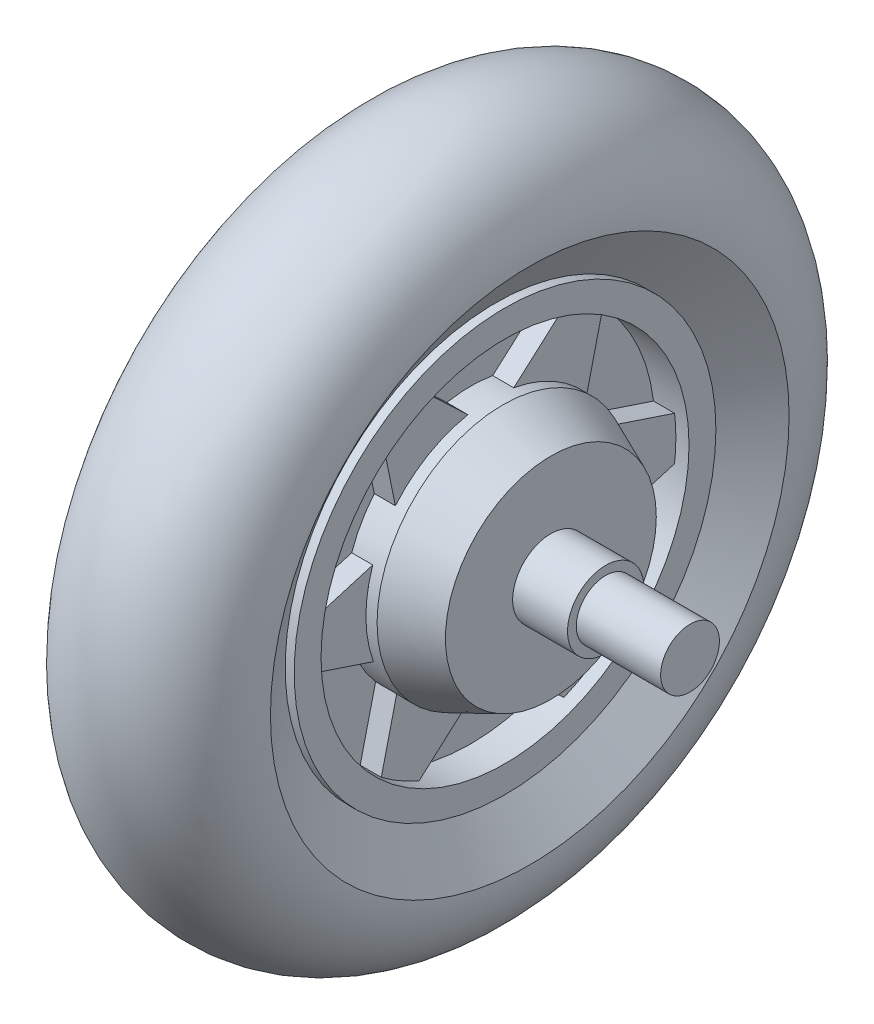
from build123d import *

# Parameters (mm, degrees)
BOSS_EXTRUDE2_DEPTH  = 5
CIRPATTERN1_COUNT    = 6
MIRROR1_COPY_1_DEPTH = 5
MIRROR1_COPY_2_DEPTH = 5
MIRROR1_COPY_3_DEPTH = 5
MIRROR1_COPY_4_DEPTH = 5
MIRROR1_COPY_5_DEPTH = 5


with BuildPart() as part:
    # Sketch2 → Revolve1 (revolve)
    with BuildSketch(Plane.XY, mode=Mode.PRIVATE) as revolve1_sk:
        with BuildLine():
            Line((-22, 61.489125293), (-14, 50))
            Line((-14, 50), (-8, 50))
            ThreePointArc((-8, 50), (-5.656854249, 44.343145751), (0, 42))
            ThreePointArc((0, 42), (5.656854249, 44.343145751), (8, 50))
            Line((8, 50), (14, 50))
            Line((14, 50), (22, 61.489125293))
            ThreePointArc((22, 61.489125293), (0, 83.489125293), (-22, 61.489125293))
        make_face()
    revolve(revolve1_sk.sketch.rotate(Axis((0, 0, 0), (1, 0, 0)), 90), axis=Axis((0, 0, 0), (1, 0, 0)))

    # Sketch3 → Revolve2 (revolve)
    with BuildSketch(Plane.XY, mode=Mode.PRIVATE) as revolve2_sk:
        with BuildLine():
            Line((-27, 9.055449855), (-40, 9.055449855))
            Line((-40, 9.055449855), (-40, 6.969952313))
            Line((-40, 6.969952313), (-60, 6.969952313))
            Line((-60, 6.969952313), (-60, 0))
            Line((-60, 0), (60, 0))
            Line((60, 0), (60, 6.969952313))
            Line((60, 6.969952313), (40, 6.969952313))
            Line((40, 6.969952313), (40, 9.055449855))
            Line((40, 9.055449855), (27, 9.055449855))
            Line((27, 9.055449855), (27, 25))
            Line((27, 25), (15.652221366, 29.861325966))
            Line((15.652221366, 29.861325966), (8, 29.861325966))
            Line((8, 29.861325966), (8, 43.630803847))
            Line((8, 43.630803847), (16.135165196, 43.630803847))
            Line((16.135165196, 43.630803847), (16.135165196, 50))
            Line((16.135165196, 50), (8, 50))
            ThreePointArc((8, 50), (0, 42), (-8, 50))
            Line((-8, 50), (-16.135165196, 50))
            Line((-16.135165196, 50), (-16.135165196, 43.630803847))
            Line((-16.135165196, 43.630803847), (-8, 43.630803847))
            Line((-8, 43.630803847), (-8, 29.861325966))
            Line((-8, 29.861325966), (-15.652221366, 29.861325966))
            Line((-15.652221366, 29.861325966), (-27, 25))
            Line((-27, 25), (-27, 9.055449855))
        make_face()
    revolve(revolve2_sk.sketch.rotate(Axis((-27, 0, 0), (-1, 0, 0)), 90), axis=Axis((-27, 0, 0), (-1, 0, 0)))

    # Sketch4 → Boss-Extrude2 (add)
    with BuildSketch(Plane(origin=(8, 0, 0), x_dir=(0, 0, -1), z_dir=(1, 0, 0))):
        with BuildLine():
            Line((-49.891400962, 3.293646928), (-28.226766869, 9.744148017))
            ThreePointArc((-28.226766869, 9.744148017), (-29.860364168, -0.239666883), (-28.066722375, -10.19597389))
            Line((-28.066722375, -10.19597389), (-49.91509062, -2.912684053))
            ThreePointArc((-49.91509062, -2.912684053), (-49.999635764, 0.190849359), (-49.891400962, 3.293646928))
        make_face()
    boss_extrude2 = extrude(amount=BOSS_EXTRUDE2_DEPTH)

    # CirPattern1: Boss-Extrude2 ×6 about axis
    cirpattern1_axis = Axis((0, 0, 0), (1, 0, 0))
    for i in range(1, CIRPATTERN1_COUNT):
        add(boss_extrude2.rotate(cirpattern1_axis, i * 360 / CIRPATTERN1_COUNT))

    # Mirror1: Boss-Extrude2 across plane
    add(boss_extrude2.mirror(Plane(origin=(0, 0, 0), x_dir=(0, 0, 1), z_dir=(1, 0, 0))))

    # Mirror1 copy 1 sketch → Mirror1 copy 1 (add)
    with BuildSketch(Plane(origin=(-8, 0, 0), x_dir=(0, 0.8660254037844386, -0.5000000000000001), z_dir=(-1, 0, 0))):
        with BuildLine():
            Line((-49.891400962, -3.293646928), (-28.226766869, -9.744148017))
            ThreePointArc((-28.226766869, -9.744148017), (-29.860364168, 0.239666883), (-28.066722375, 10.19597389))
            Line((-28.066722375, 10.19597389), (-49.91509062, 2.912684053))
            ThreePointArc((-49.91509062, 2.912684053), (-49.999635764, -0.190849359), (-49.891400962, -3.293646928))
        make_face()
    extrude(amount=MIRROR1_COPY_1_DEPTH)

    # Mirror1 copy 2 sketch → Mirror1 copy 2 (add)
    with BuildSketch(Plane(origin=(-8, 0, 0), x_dir=(0, 0.8660254037844387, 0.4999999999999998), z_dir=(-1, 0, 0))):
        with BuildLine():
            Line((-49.891400962, -3.293646928), (-28.226766869, -9.744148017))
            ThreePointArc((-28.226766869, -9.744148017), (-29.860364168, 0.239666883), (-28.066722375, 10.19597389))
            Line((-28.066722375, 10.19597389), (-49.91509062, 2.912684053))
            ThreePointArc((-49.91509062, 2.912684053), (-49.999635764, -0.190849359), (-49.891400962, -3.293646928))
        make_face()
    extrude(amount=MIRROR1_COPY_2_DEPTH)

    # Mirror1 copy 3 sketch → Mirror1 copy 3 (add)
    with BuildSketch(Plane.ZY.offset(8)):
        with BuildLine():
            Line((-49.891400962, -3.293646928), (-28.226766869, -9.744148017))
            ThreePointArc((-28.226766869, -9.744148017), (-29.860364168, 0.239666883), (-28.066722375, 10.19597389))
            Line((-28.066722375, 10.19597389), (-49.91509062, 2.912684053))
            ThreePointArc((-49.91509062, 2.912684053), (-49.999635764, -0.190849359), (-49.891400962, -3.293646928))
        make_face()
    extrude(amount=MIRROR1_COPY_3_DEPTH)

    # Mirror1 copy 4 sketch → Mirror1 copy 4 (add)
    with BuildSketch(Plane(origin=(-8, 0, 0), x_dir=(0, -0.8660254037844384, 0.5000000000000004), z_dir=(-1, 0, 0))):
        with BuildLine():
            Line((-49.891400962, -3.293646928), (-28.226766869, -9.744148017))
            ThreePointArc((-28.226766869, -9.744148017), (-29.860364168, 0.239666883), (-28.066722375, 10.19597389))
            Line((-28.066722375, 10.19597389), (-49.91509062, 2.912684053))
            ThreePointArc((-49.91509062, 2.912684053), (-49.999635764, -0.190849359), (-49.891400962, -3.293646928))
        make_face()
    extrude(amount=MIRROR1_COPY_4_DEPTH)

    # Mirror1 copy 5 sketch → Mirror1 copy 5 (add)
    with BuildSketch(Plane(origin=(-8, 0, 0), x_dir=(0, -0.8660254037844386, -0.5000000000000001), z_dir=(-1, 0, 0))):
        with BuildLine():
            Line((-49.891400962, -3.293646928), (-28.226766869, -9.744148017))
            ThreePointArc((-28.226766869, -9.744148017), (-29.860364168, 0.239666883), (-28.066722375, 10.19597389))
            Line((-28.066722375, 10.19597389), (-49.91509062, 2.912684053))
            ThreePointArc((-49.91509062, 2.912684053), (-49.999635764, -0.190849359), (-49.891400962, -3.293646928))
        make_face()
    extrude(amount=MIRROR1_COPY_5_DEPTH)


solid = part.part
